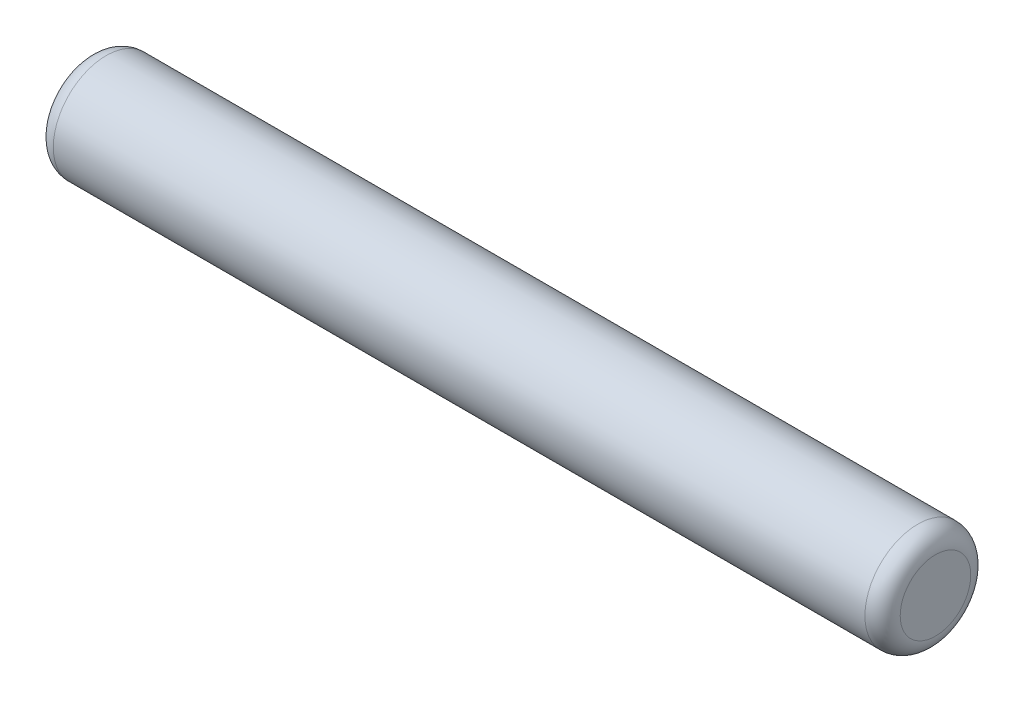
from build123d import *


with BuildPart() as part:
    # Sketch1 → Revolve1 (revolve)
    with BuildSketch(Plane.XY, mode=Mode.PRIVATE) as revolve1_sk:
        with BuildLine():
            Line((0, 0), (0, 3.175))
            ThreePointArc((0, 3.175), (0.464967985, 4.297532015), (1.5875, 4.7625))
            Line((1.5875, 4.7625), (74.6125, 4.7625))
            ThreePointArc((74.6125, 4.7625), (75.735032015, 4.297532015), (76.2, 3.175))
            Line((76.2, 3.175), (76.2, 0))
            Line((76.2, 0), (0, 0))
        make_face()
    revolve(revolve1_sk.sketch.rotate(Axis((-7.360350386, 0, 0), (1, 0, 0)), 90), axis=Axis((-7.360350386, 0, 0), (1, 0, 0)))


solid = part.part
